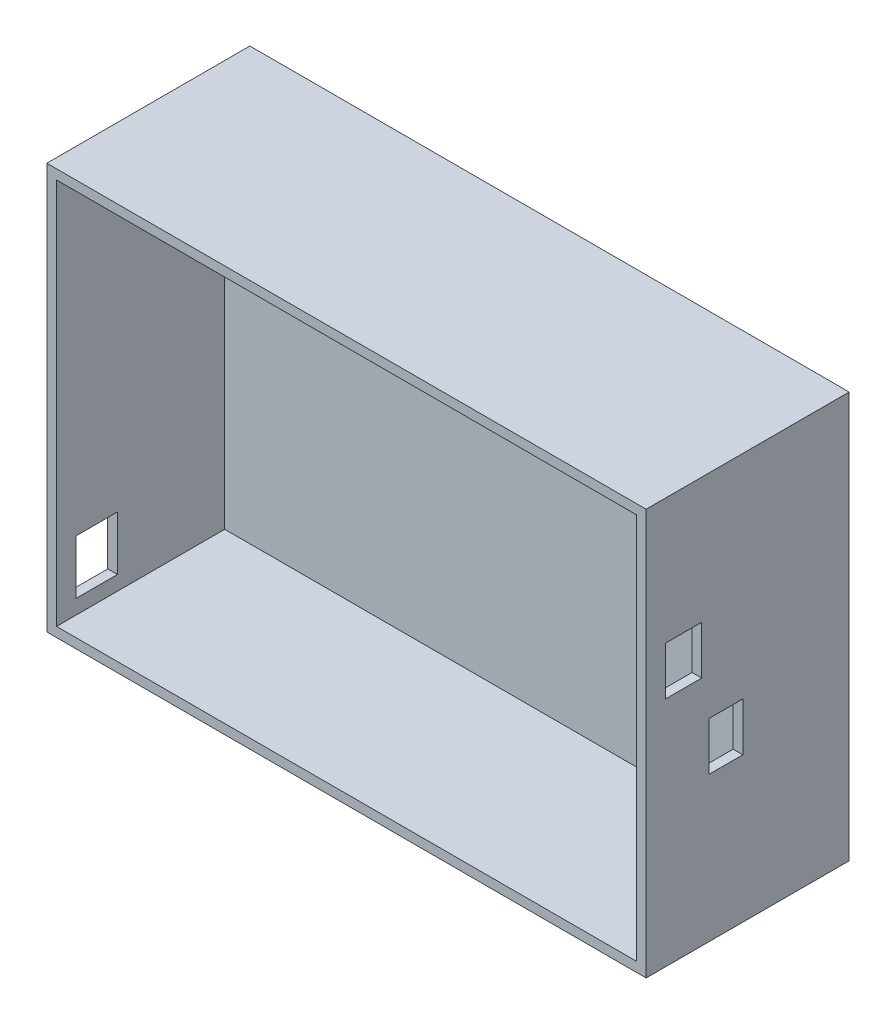
from build123d import *

# Parameters (mm, degrees)
SKETCH1_W           = 157.48
SKETCH1_H           = 106.68
BOSS_EXTRUDE1_DEPTH = 53.34
SKETCH3_W           = 152.4
SKETCH3_H           = 101.6
CUT_EXTRUDE1_DEPTH  = 44.196
SKETCH4_W           = 8.89
SKETCH4_H           = 12.7
CUT_EXTRUDE2_DEPTH  = 43.18
SKETCH6_W           = 10.922
SKETCH6_H           = 14.224
CUT_EXTRUDE3_DEPTH  = 43.18
SKETCH7_W           = 9.525
SKETCH7_H           = 12.7
CUT_EXTRUDE4_DEPTH  = 12.7


with BuildPart() as part:
    # Sketch1 → Boss-Extrude1 (new body)
    with BuildSketch(Plane.XY):
        Rectangle(SKETCH1_W, SKETCH1_H)
    extrude(amount=BOSS_EXTRUDE1_DEPTH)

    # Sketch3 → Cut-Extrude1 (cut)
    with BuildSketch(Plane.XY.offset(53.34)):
        Rectangle(SKETCH3_W, SKETCH3_H)
    extrude(amount=-CUT_EXTRUDE1_DEPTH, mode=Mode.SUBTRACT)

    # Sketch4 → Cut-Extrude2 (cut)
    with BuildSketch(Plane(origin=(78.74, 0, 0), x_dir=(0, 0, -1), z_dir=(1, 0, 0))):
        with Locations((-32.385, -8.89)):
            Rectangle(SKETCH4_W, SKETCH4_H)
    extrude(amount=-CUT_EXTRUDE2_DEPTH, mode=Mode.SUBTRACT)

    # Sketch6 → Cut-Extrude3 (cut)
    with BuildSketch(Plane.ZY.offset(78.74)):
        with Locations((42.799, -39.878)):
            Rectangle(SKETCH6_W, SKETCH6_H)
    extrude(amount=-CUT_EXTRUDE3_DEPTH, mode=Mode.SUBTRACT)

    # Sketch7 → Cut-Extrude4 (cut)
    with BuildSketch(Plane(origin=(78.74, 0, 0), x_dir=(0, 0, -1), z_dir=(1, 0, 0))):
        with Locations((-43.4975, 13.97)):
            Rectangle(SKETCH7_W, SKETCH7_H)
    extrude(amount=-CUT_EXTRUDE4_DEPTH, mode=Mode.SUBTRACT)


solid = part.part
